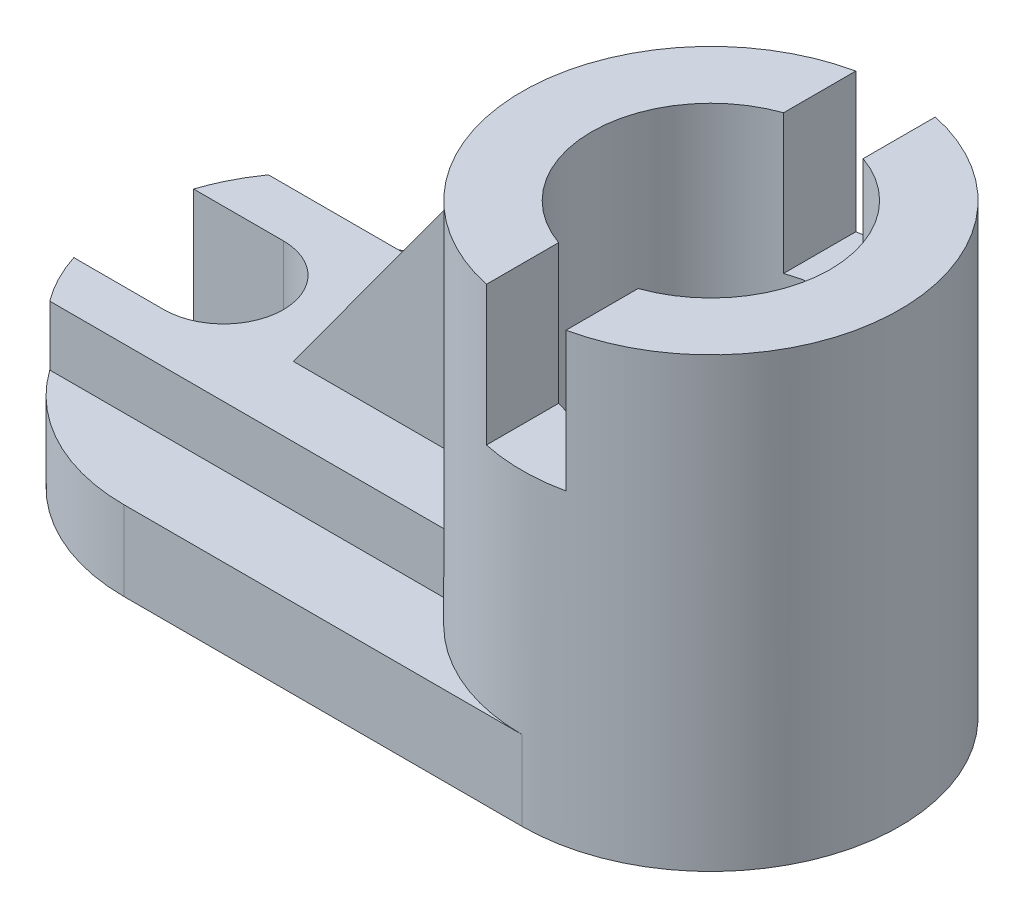
from build123d import *

# Parameters (mm, degrees)
SKETCH_1_R               = 19
EXTRUDE_5_DEPTH          = 45
EXTRUDE_7_DEPTH          = 8
EXTRUDE_8_DEPTH          = 6
CUT_EXTRUDE_2_DEPTH      = 70.304018822
RIB_2_REACH              = 77.904
SKETCH_7_WALL_W          = 186.009693892
SKETCH_7_WALL_H          = 8
SKETCH_9_R               = 12
CUT_EXTRUDE_3_DEPTH      = 76.903604817
CUT_EXTRUDE_5_DEPTH      = 76.903604758
CUT_EXTRUDE_5_DEPTH_BACK = 76.903604758
SKETCH_10_W              = 8
SKETCH_10_H              = 19


with BuildPart() as part:
    # 草图1 → 凸台-拉伸5 (new body)
    with BuildSketch(Plane(origin=(0, 0, 0), x_dir=(1, 0, 0), z_dir=(0, 1, 0))):
        with Locations(Location((0, 0, 0), (0, 0, 90))):
            Circle(SKETCH_1_R)
    extrude(amount=EXTRUDE_5_DEPTH)

    # 草图2 → 凸台-拉伸7 (add)
    with BuildSketch(Plane(origin=(0, 0, 0), x_dir=(1, 0, 0), z_dir=(0, 1, 0))):
        with BuildLine():
            Line((-40, 19), (0, 19))
            Line((0, 19), (0, -19))
            Line((0, -19), (-40, -19))
            ThreePointArc((-40, -19), (-59, 0), (-40, 19))
        make_face()
    extrude(amount=EXTRUDE_7_DEPTH)

    # 草图4 → 凸台-拉伸8 (add)
    with BuildSketch(Plane(origin=(0, 8, 0), x_dir=(1, 0, 0), z_dir=(0, 1, 0))):
        with BuildLine():
            Line((-10, 11), (-55.491933385, 11))
            add(Edge.make_bspline(
                [(-55.491933385, 11), (-60.019399323, 4.706159899), (-60.317992404, -4.540611583), (-55.491933385, -11)],
                knots=[0, 0, 0, 0, 1, 1, 1, 1], degree=3))
            Line((-55.491933385, -11), (-10, -11))
            Line((-10, -11), (-10, 11))
        make_face()
    extrude(amount=EXTRUDE_8_DEPTH)

    # 草图5 → 切除-拉伸2 (cut, through all)
    with BuildSketch(Plane(origin=(0, 14, 0), x_dir=(1, 0, 0), z_dir=(0, 1, 0))):
        with BuildLine():
            Line((-49, 6), (-58.020969044, 6))
            Line((-58.020969044, 6), (-65.909101598, 0.806430717))
            Line((-65.909101598, 0.806430717), (-58.020969044, -6))
            Line((-58.020969044, -6), (-49, -6))
            ThreePointArc((-49, -6), (-43, 0), (-49, 6))
        make_face()
    extrude(amount=-CUT_EXTRUDE_2_DEPTH, mode=Mode.SUBTRACT)

    # 草图7 wall → 筋2 (add, up to next)
    with BuildSketch(Plane(origin=(-28.5, 27, 0), x_dir=(-0.590016589342, -0.807391122258, 0), z_dir=(0.807391122258, -0.590016589342, 0)), mode=Mode.PRIVATE) as rib_2_sk1:
        Rectangle(SKETCH_7_WALL_W, SKETCH_7_WALL_H)
    rib_2_tool1 = extrude(rib_2_sk1.sketch, amount=RIB_2_REACH, mode=Mode.PRIVATE) - part.part
    add(rib_2_tool1.solids().sort_by_distance((-28.5, 27, 0))[0])

    # 草图9 → 切除-拉伸3 (cut, through all)
    with BuildSketch(Plane(origin=(0, 45, 0), x_dir=(1, 0, 0), z_dir=(0, 1, 0))):
        with Locations(Location((0, 0, 0), (0, 0, 270))):
            Circle(SKETCH_9_R)
    extrude(amount=-CUT_EXTRUDE_3_DEPTH, mode=Mode.SUBTRACT)

    # 草图10 → 切除-拉伸5 (cut, two sides: drawn at the far end of the back side and taken through both)
    with BuildSketch(Plane.XY.offset(-CUT_EXTRUDE_5_DEPTH_BACK)):
        with Locations((0, 40.5)):
            Rectangle(SKETCH_10_W, SKETCH_10_H)
    extrude(amount=CUT_EXTRUDE_5_DEPTH + CUT_EXTRUDE_5_DEPTH_BACK, mode=Mode.SUBTRACT)


solid = part.part
